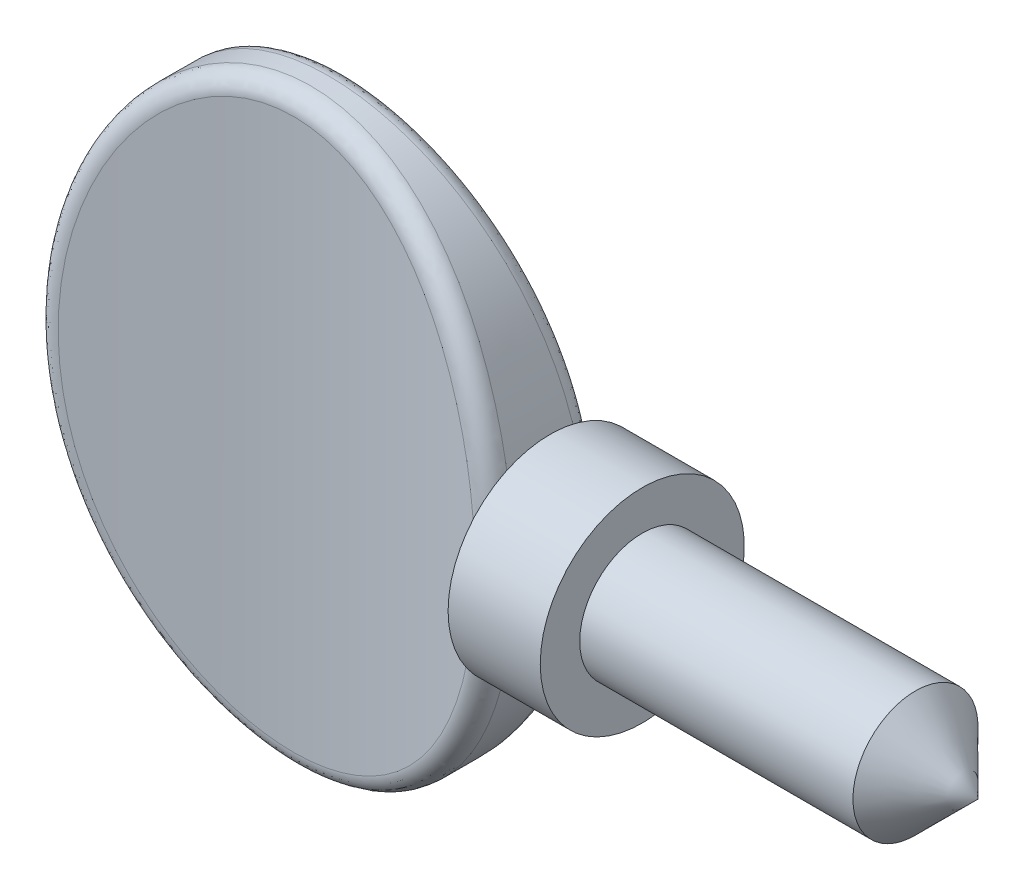
from build123d import *

# Parameters (mm, degrees)
SKETCH1_RX              = 11.303
SKETCH1_RY              = 8.889999999999999
EXTRUDE1_DEPTH          = 2.286
CUT_EXTRUDE1_DEPTH      = 15.560759080487529
CUT_EXTRUDE1_DEPTH_BACK = 15.560759080487529
SKETCH2_OUTSIDE_W       = 25.603999999999996
SKETCH2_OUTSIDE_H       = 12.396
FILLET3_R               = 0.6773333333333333


with BuildPart() as part:
    # Sketch1 → Extrude1 (new, symmetric)
    with BuildSketch(Plane.XY):
        with Locations(Location((0, 0), (0, 0, 90))):
            Ellipse(SKETCH1_RX, SKETCH1_RY)
    extrude(amount=EXTRUDE1_DEPTH, both=True)

    # Sketch2 outside → Cut-Extrude1 (cut, two sides: drawn at the far end of the back side and taken through both)
    with BuildSketch(Plane(origin=(0, 0, 0), x_dir=(1, 0, 0), z_dir=(0, 1, 0)).offset(-CUT_EXTRUDE1_DEPTH_BACK)):
        Rectangle(SKETCH2_OUTSIDE_W, SKETCH2_OUTSIDE_H)
        with BuildLine():
            Line((-8.889999999999999, 2.286), (-8.889999999999999, -2.286))
            ThreePointArc((-8.889999999999999, -2.286), (1.94e-15, -1.0159999999999982), (8.889999999999999, -2.286))
            Line((8.889999999999999, -2.286), (8.889999999999999, 2.286))
            ThreePointArc((8.889999999999999, 2.286), (1.94e-15, 1.0159999999999982), (-8.889999999999999, 2.286))
        make_face(mode=Mode.SUBTRACT)
    extrude(amount=CUT_EXTRUDE1_DEPTH + CUT_EXTRUDE1_DEPTH_BACK, mode=Mode.SUBTRACT)

    # Fillet3
    fillet3_edges = [part.edges().sort_by_distance(p)[0] for p in [
        (-6.499256061e-08, -11.302999999991183, 1.0159999999964504),
        (8.835220095e-08, -11.302999999991183, -1.0159999999964522),
    ]]
    fillet(fillet3_edges, radius=FILLET3_R)

    # Sketch3 → Revolve1 (revolve)
    with BuildSketch(Plane(origin=(0, 0, 0), x_dir=(1, 0, 0), z_dir=(0, 1, 0))):
        with BuildLine():
            Line((12.445999999999996, 3.9369999999999994), (12.445999999999996, 2.413))
            Line((12.445999999999996, 2.413), (22.98700000000001, 2.413))
            Line((22.98700000000001, 2.413), (25.4, 0))
            Line((25.4, 0), (7.236423048052516, 0))
            Line((7.236423048052516, 0), (7.236423048052516, 1.8516557328217895))
            ThreePointArc((7.236423048052516, 1.8516557328217895), (8.426438076724871, 2.6063068114075874), (8.889999999999999, 3.9370000000000003))
            Line((8.889999999999999, 3.9370000000000003), (12.445999999999996, 3.9369999999999994))
        make_face()
    revolve(axis=Axis((0, 0, 0), (1, 0, 0)))


solid = part.part
